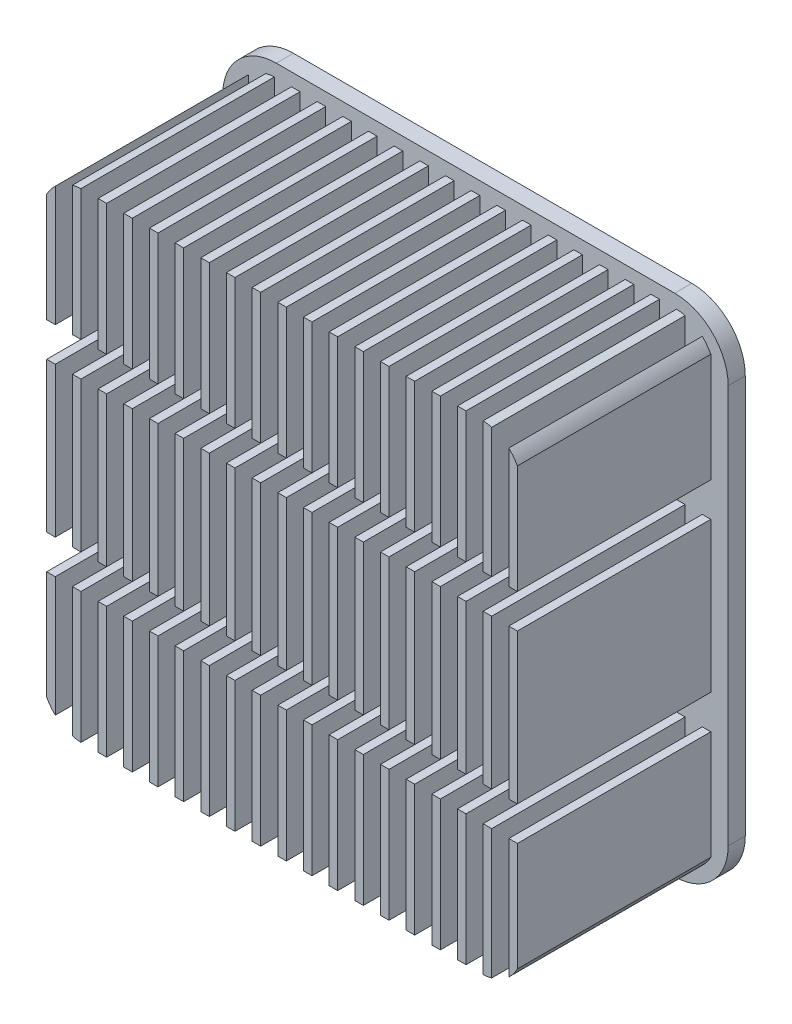
from build123d import *

# Parameters (mm, degrees)
BOSS_EXTRUDE1_DEPTH = 1.016
SKETCH3_W           = 0.508
SKETCH3_H           = 29
BOSS_EXTRUDE2_DEPTH = 11.483999892
SKETCH5_OUTSIDE_W   = 40.846
SKETCH5_OUTSIDE_H   = 40.846
CUT_EXTRUDE1_DEPTH  = 11.483999892
SKETCH8_W           = 32.248483867
SKETCH8_H           = 2.032
CUT_EXTRUDE2_DEPTH  = 11.483999892


with BuildPart() as part:
    # Sketch2 → Boss-Extrude1 (new body)
    with BuildSketch(Plane.XY):
        with BuildLine():
            Line((-15, 11.825), (-15, -11.825))
            ThreePointArc((-15, -11.825), (-14.07006403, -14.07006403), (-11.825, -15))
            Line((-11.825, -15), (11.825, -15))
            ThreePointArc((11.825, -15), (14.07006403, -14.07006403), (15, -11.825))
            Line((15, -11.825), (15, 11.825))
            ThreePointArc((15, 11.825), (14.07006403, 14.07006403), (11.825, 15))
            Line((11.825, 15), (-11.825, 15))
            ThreePointArc((-11.825, 15), (-14.07006403, 14.07006403), (-15, 11.825))
        make_face()
    extrude(amount=BOSS_EXTRUDE1_DEPTH)

    # Sketch3 → Boss-Extrude2 (add)
    with BuildSketch(Plane.XY.offset(1.016)):
        Rectangle(SKETCH3_W, SKETCH3_H)
        with Locations((1.524, 0)):
            Rectangle(SKETCH3_W, SKETCH3_H)
        with Locations((3.048, 0)):
            Rectangle(SKETCH3_W, SKETCH3_H)
        with Locations((4.572, 0)):
            Rectangle(SKETCH3_W, SKETCH3_H)
        with Locations((6.096, 0)):
            Rectangle(SKETCH3_W, SKETCH3_H)
        with Locations((7.62, 0)):
            Rectangle(SKETCH3_W, SKETCH3_H)
        with Locations((9.144, 0)):
            Rectangle(SKETCH3_W, SKETCH3_H)
        with Locations((10.668, 0)):
            Rectangle(SKETCH3_W, SKETCH3_H)
        with Locations((12.192, 0)):
            Rectangle(SKETCH3_W, SKETCH3_H)
        with Locations((13.716, 0)):
            Rectangle(SKETCH3_W, SKETCH3_H)
        with Locations((-1.524, 0)):
            Rectangle(SKETCH3_W, SKETCH3_H)
        with Locations((-3.048, 0)):
            Rectangle(SKETCH3_W, SKETCH3_H)
        with Locations((-4.572, 0)):
            Rectangle(SKETCH3_W, SKETCH3_H)
        with Locations((-6.096, 0)):
            Rectangle(SKETCH3_W, SKETCH3_H)
        with Locations((-7.62, 0)):
            Rectangle(SKETCH3_W, SKETCH3_H)
        with Locations((-9.144, 0)):
            Rectangle(SKETCH3_W, SKETCH3_H)
        with Locations((-10.668, 0)):
            Rectangle(SKETCH3_W, SKETCH3_H)
        with Locations((-12.192, 0)):
            Rectangle(SKETCH3_W, SKETCH3_H)
        with Locations((-13.716, 0)):
            Rectangle(SKETCH3_W, SKETCH3_H)
    extrude(amount=BOSS_EXTRUDE2_DEPTH)

    # Sketch5 outside → Cut-Extrude1 (cut)
    with BuildSketch(Plane.XY.offset(12.499999892)):
        Rectangle(SKETCH5_OUTSIDE_W, SKETCH5_OUTSIDE_H)
        with BuildLine():
            Line((-14.238, 11.825), (-14.238, -11.825))
            ThreePointArc((-14.238, -11.825), (-13.531248663, -13.531248663), (-11.825, -14.238))
            Line((-11.825, -14.238), (11.825, -14.238))
            ThreePointArc((11.825, -14.238), (13.531248663, -13.531248663), (14.238, -11.825))
            Line((14.238, -11.825), (14.238, 11.825))
            ThreePointArc((14.238, 11.825), (13.531248663, 13.531248663), (11.825, 14.238))
            Line((11.825, 14.238), (-11.825, 14.238))
            ThreePointArc((-11.825, 14.238), (-13.531248663, 13.531248663), (-14.238, 11.825))
        make_face(mode=Mode.SUBTRACT)
    extrude(amount=-CUT_EXTRUDE1_DEPTH, mode=Mode.SUBTRACT)

    # Sketch8 → Cut-Extrude2 (cut)
    with BuildSketch(Plane.XY.offset(12.499999892)):
        with Locations((-0.229229702, -5.461)):
            Rectangle(SKETCH8_W, SKETCH8_H)
        with Locations((-0.229229702, 5.461)):
            Rectangle(SKETCH8_W, SKETCH8_H)
    extrude(amount=-CUT_EXTRUDE2_DEPTH, mode=Mode.SUBTRACT)


solid = part.part
